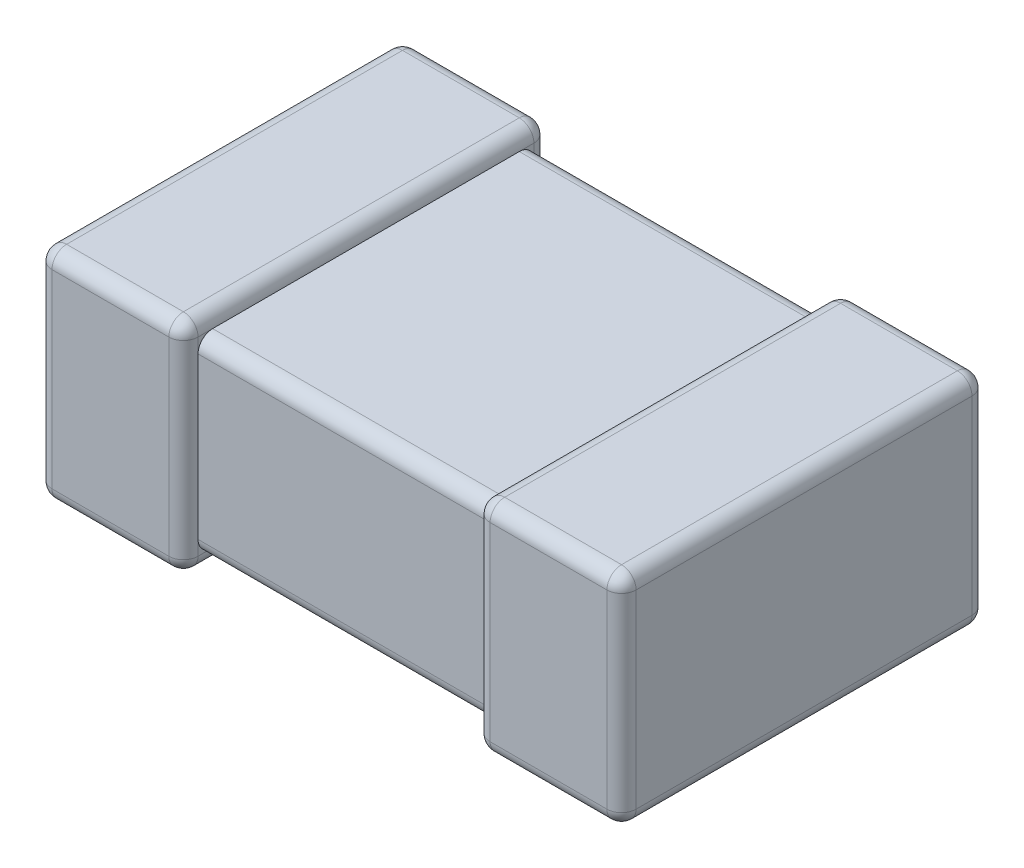
from build123d import *

# Parameters (mm, degrees)
SKETCH1_W             = 1.9
SKETCH1_H             = 1.15
BOSS_EXTRUDE1_DEPTH   = 0.65
SKETCH2_W             = 0.5
SKETCH2_H             = 1.25
BOSS_EXTRUDE2_DEPTH   = 0.75
BOSS_EXTRUDE2_2_DEPTH = 0.75
FILLET1_R             = 0.05
FILLET2_R             = 0.05
FILLET3_R             = 0.05


with BuildPart() as part:
    # Sketch1 → Boss-Extrude1 (new body)
    with BuildSketch(Plane(origin=(0, 0.05, 0), x_dir=(1, 0, 0), z_dir=(0, 1, 0))):
        Rectangle(SKETCH1_W, SKETCH1_H)
    extrude(amount=BOSS_EXTRUDE1_DEPTH)

    # Fillet3
    fillet3_edges = [part.edges().sort_by_distance(p)[0] for p in [
        (0.95, 0.7, 0),
        (0, 0.7, -0.575),
        (-0.95, 0.7, 0),
        (0, 0.05, -0.575),
        (0.95, 0.05, 0),
        (0, 0.05, 0.575),
        (-0.95, 0.05, 0),
        (-0.95, 0.375, -0.575),
        (0.95, 0.375, -0.575),
        (0.95, 0.375, 0.575),
        (-0.95, 0.375, 0.575),
        (0, 0.7, 0.575),
    ]]
    fillet(fillet3_edges, radius=FILLET3_R)


with BuildPart() as body_2:
    # Sketch2 → Boss-Extrude2 (new body)
    with BuildSketch(Plane(origin=(0, 0, 0), x_dir=(1, 0, 0), z_dir=(0, 1, 0))):
        with Locations((-0.75, 0)):
            Rectangle(SKETCH2_W, SKETCH2_H)
    extrude(amount=BOSS_EXTRUDE2_DEPTH)

    # Fillet2
    fillet2_edges = [body_2.edges().sort_by_distance(p)[0] for p in [
        (-1, 0.375, 0.625),
        (-0.75, 0, 0.625),
        (-0.5, 0.375, 0.625),
        (-0.5, 0, 0),
        (-0.5, 0.375, -0.625),
        (-0.75, 0, -0.625),
        (-0.75, 0.75, -0.625),
        (-1, 0.75, 0),
        (-0.75, 0.75, 0.625),
        (-0.5, 0.75, 0),
        (-1, 0.375, -0.625),
        (-1, 0, 0),
    ]]
    fillet(fillet2_edges, radius=FILLET2_R)


with BuildPart() as body_3:
    # Sketch2 → Boss-Extrude2 2 (new body)
    with BuildSketch(Plane(origin=(0, 0, 0), x_dir=(1, 0, 0), z_dir=(0, 1, 0))):
        with Locations((0.75, 0)):
            Rectangle(SKETCH2_W, SKETCH2_H)
    extrude(amount=BOSS_EXTRUDE2_2_DEPTH)

    # Fillet1
    fillet1_edges = [body_3.edges().sort_by_distance(p)[0] for p in [
        (0.5, 0.375, -0.625),
        (0.5, 0, 0),
        (0.5, 0.375, 0.625),
        (0.75, 0, 0.625),
        (1, 0.375, 0.625),
        (1, 0, 0),
        (1, 0.375, -0.625),
        (0.75, 0, -0.625),
        (0.75, 0.75, -0.625),
        (0.5, 0.75, 0),
        (0.75, 0.75, 0.625),
        (1, 0.75, 0),
    ]]
    fillet(fillet1_edges, radius=FILLET1_R)


solid = Compound([part.part, body_2.part, body_3.part])
